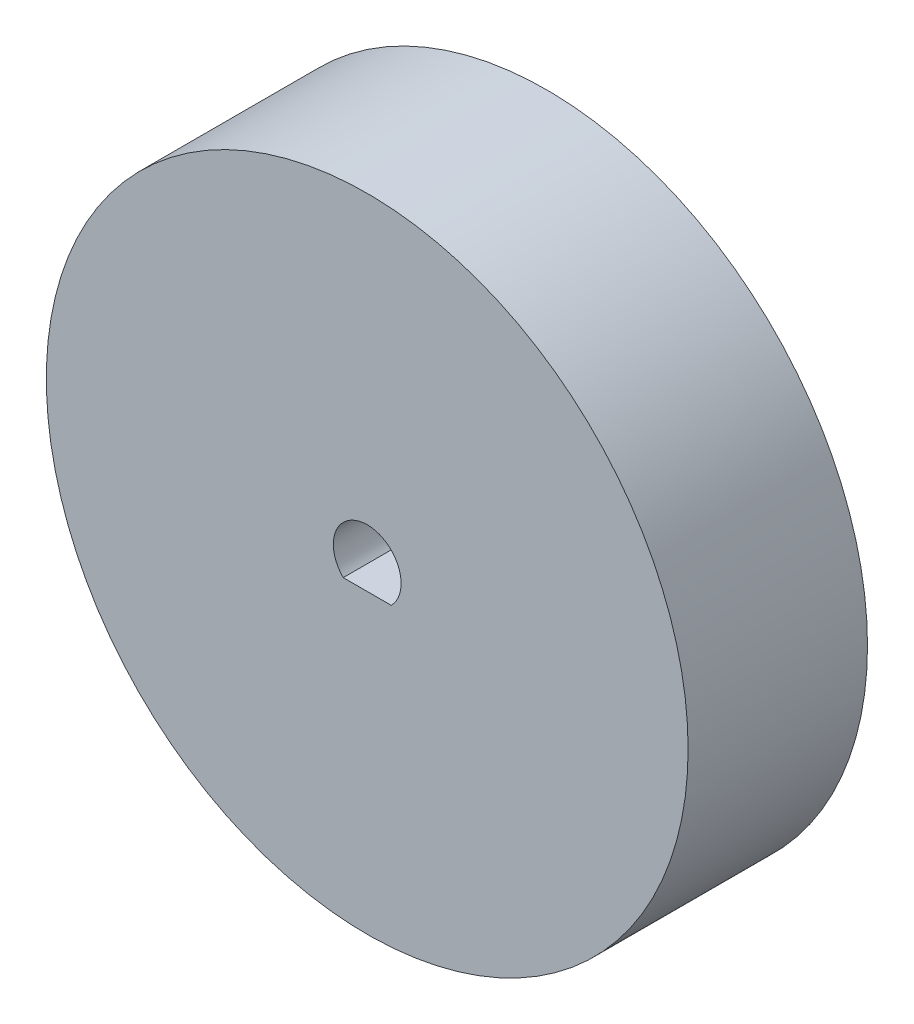
from build123d import *

# Parameters (mm, degrees)
SKETCH1_R           = 16.1
BOSS_EXTRUDE1_DEPTH = 9


with BuildPart() as part:
    # Sketch1 → Boss-Extrude1 (new body)
    with BuildSketch(Plane.XY):
        Circle(SKETCH1_R)
        with BuildLine():
            Line((-1.204159458, -1.2), (1.204159458, -1.2))
            ThreePointArc((1.204159458, -1.2), (0, 1.7), (-1.204159458, -1.2))
        make_face(mode=Mode.SUBTRACT)
    extrude(amount=BOSS_EXTRUDE1_DEPTH)


solid = part.part
